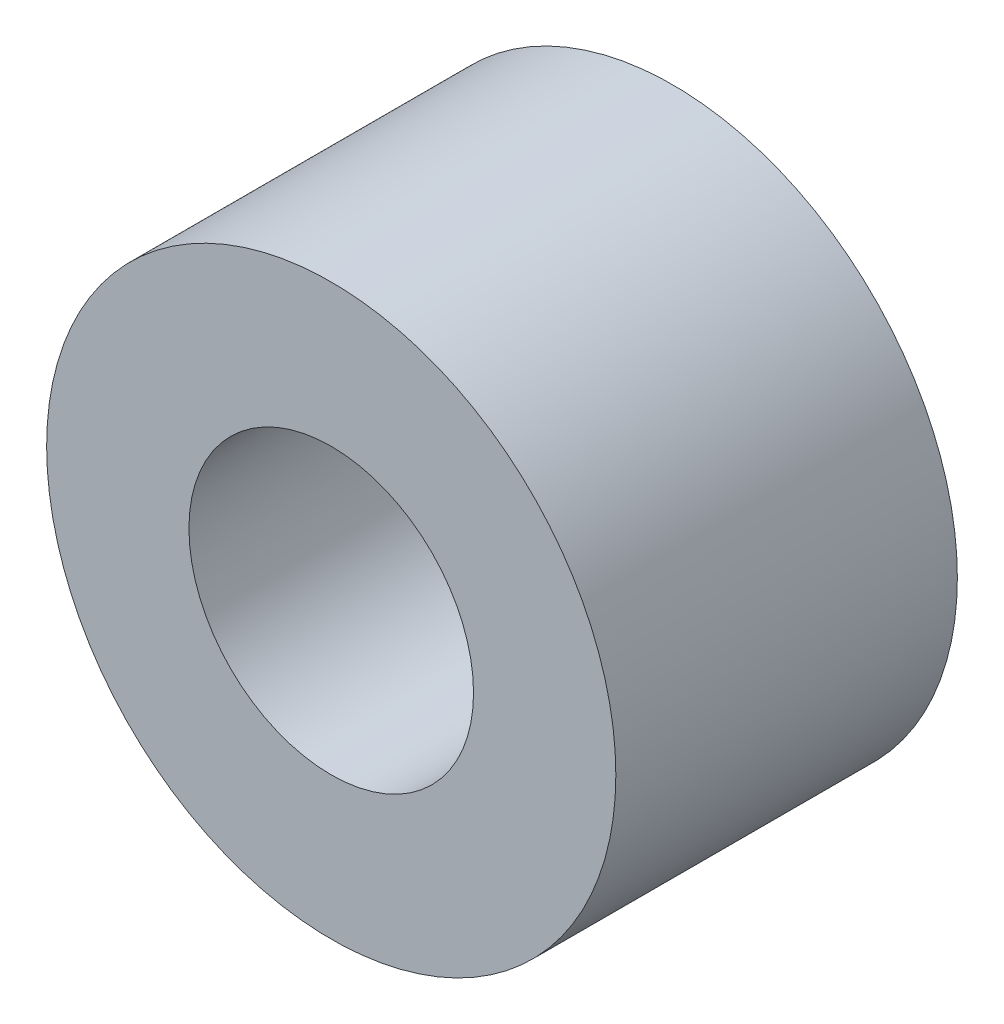
from build123d import *

# Parameters (mm, degrees)
CROQUIS1_R              = 5
CROQUIS1_R_2            = 2.5
SALIENTE_EXTRUIR1_DEPTH = 6


with BuildPart() as part:
    # Croquis1 → Saliente-Extruir1 (new body)
    with BuildSketch(Plane.XY):
        with Locations((45.5, 14.8)):
            Circle(CROQUIS1_R)
        with Locations((45.5, 14.8)):
            Circle(CROQUIS1_R_2, mode=Mode.SUBTRACT)
    extrude(amount=SALIENTE_EXTRUIR1_DEPTH)


solid = part.part
